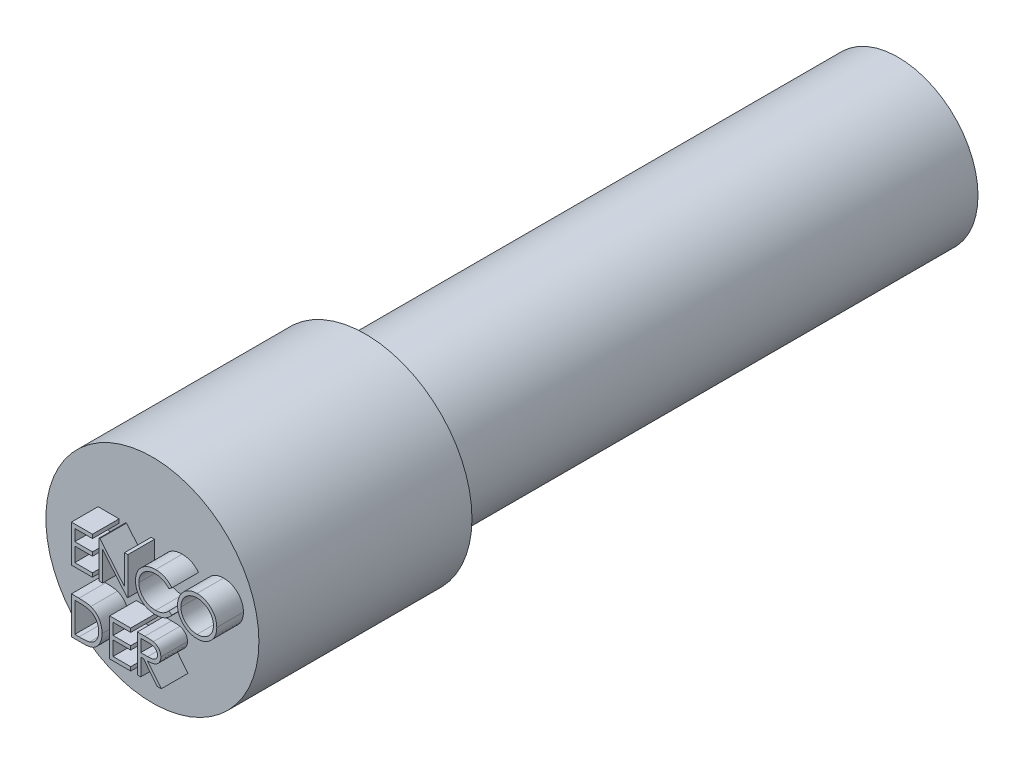
from build123d import *

# Parameters (mm, degrees)
SKETCH1_R           = 1.5
BOSS_EXTRUDE1_DEPTH = 10
SKETCH2_R           = 2
BOSS_EXTRUDE2_DEPTH = 4
BOSS_EXTRUDE3_DEPTH = 0.5


with BuildPart() as part:
    # Sketch1 → Boss-Extrude1 (new body)
    with BuildSketch(Plane.XY):
        with Locations((0, 2.269253886)):
            Circle(SKETCH1_R)
    extrude(amount=BOSS_EXTRUDE1_DEPTH)

    # Sketch2 → Boss-Extrude2 (add)
    with BuildSketch(Plane.XY.offset(10)):
        with Locations((0, 2.269253886)):
            Circle(SKETCH2_R)
    extrude(amount=BOSS_EXTRUDE2_DEPTH)

    # Sketch3 → Boss-Extrude3 (add)
    # profile 1 of 7: a face of its own
    with BuildSketch(Plane.XY.offset(14)):
        Polygon((-1.019314655, 2.951432691), (-0.62444286, 2.951432691), (-0.62444286, 2.879637819), (-0.956494142, 2.879637819), (-0.956494142, 2.664253204), (-0.62444286, 2.664253204), (-0.62444286, 2.592458332), (-0.956494142, 2.592458332), (-0.956494142, 2.323227563), (-0.62444286, 2.323227563), (-0.62444286, 2.251432691), (-1.019314655, 2.251432691), align=None)
    # profile 2 of 7: a face of its own
    with BuildSketch(Plane.XY.offset(14)):
        Polygon((-0.498801835, 2.251432691), (-0.498801835, 2.951432691), (-0.485620745, 2.951432691), (-0.023160809, 2.400491185), (-0.023160809, 2.951432691), (0.039659704, 2.951432691), (0.039659704, 2.251432691), (0.025356819, 2.251432691), (-0.435981322, 2.801112178), (-0.435981322, 2.251432691), align=None)
    # profile 3 of 7: a face of its own
    with BuildSketch(Plane.XY.offset(14)):
        with BuildLine():
            Line((0.86530073, 2.822987178), (0.810332781, 2.780919871))
            add(Edge.make_bspline(
                [(0.810332781, 2.780919871), (0.806411603, 2.785593065), (0.798622114, 2.794876448), (0.786090273, 2.807912357), (0.773029945, 2.820125409), (0.75944612, 2.831573785), (0.745094297, 2.841857138), (0.730322137, 2.851511359), (0.714882528, 2.860164906), (0.693532181, 2.870657503), (0.665602611, 2.881606734), (0.630443643, 2.890787381), (0.593741424, 2.896631616), (0.568701904, 2.897264584), (0.555965794, 2.897586537)],
                knots=[0, 0, 0, 0, 0.757959112, 1.505699292, 2.245454638, 2.979532153, 3.711538275, 4.438200793, 5.171680507, 5.909471876, 7.393775596, 8.890124382, 10.418191784, 12, 12, 12, 12], degree=3))
            add(Edge.make_bspline(
                [(0.555965794, 2.897586537), (0.548949134, 2.897505745), (0.534980935, 2.89734491), (0.514251241, 2.895223085), (0.49390863, 2.892240843), (0.473966337, 2.887815778), (0.454449745, 2.882221254), (0.435231265, 2.875536171), (0.416589145, 2.867265203), (0.398265497, 2.858123551), (0.380709655, 2.847798063), (0.364098646, 2.836535392), (0.348493052, 2.824461573), (0.33388053, 2.811531352), (0.32024614, 2.797802959), (0.307688678, 2.783130091), (0.296251596, 2.767559656), (0.285708191, 2.751296975), (0.276265644, 2.734389417), (0.268359668, 2.716774403), (0.261358644, 2.698753582), (0.255818795, 2.68012335), (0.251433892, 2.661014797), (0.248408359, 2.641376639), (0.246310665, 2.621249903), (0.24615063, 2.607608041), (0.24606996, 2.600731569)],
                knots=[0, 0, 0, 0, 1.054917814, 2.100044995, 3.131103042, 4.146048494, 5.169673617, 6.183595914, 7.203665975, 8.234915748, 9.262203917, 10.264457458, 11.251630812, 12.227803204, 13.197192746, 14.159520551, 15.12972552, 16.100847026, 17.073214652, 18.039054194, 19.002613845, 19.979014051, 20.95965708, 21.949030935, 22.966165397, 24, 24, 24, 24], degree=3))
            add(Edge.make_bspline(
                [(0.24606996, 2.600731569), (0.246322324, 2.590385305), (0.246817807, 2.570071788), (0.251227474, 2.540317666), (0.257928492, 2.511813532), (0.267971607, 2.484737563), (0.280355418, 2.458755892), (0.29600354, 2.434308121), (0.314126847, 2.411024808), (0.334981731, 2.389456218), (0.357862894, 2.369753473), (0.382412477, 2.352403357), (0.408569334, 2.337940381), (0.43604466, 2.325905191), (0.465049883, 2.316653846), (0.495532844, 2.310141021), (0.527427243, 2.305892585), (0.549221123, 2.305485847), (0.560312749, 2.305278845)],
                knots=[0, 0, 0, 0, 1.029171465, 2.020641659, 2.987623507, 3.938342917, 4.889210282, 5.84687017, 6.821220943, 7.821438502, 8.827599549, 9.822697543, 10.807740252, 11.797342354, 12.80366471, 13.83203677, 14.896651826, 16, 16, 16, 16], degree=3))
            add(Edge.make_bspline(
                [(0.560312749, 2.305278845), (0.572533287, 2.305616601), (0.596586228, 2.306281386), (0.631859834, 2.311913235), (0.665626987, 2.321044819), (0.697889504, 2.333824403), (0.728556433, 2.350437461), (0.757675765, 2.370577036), (0.785272079, 2.394434703), (0.801866336, 2.412651329), (0.810332781, 2.421945512)],
                knots=[0, 0, 0, 0, 1.028121516, 2.023589091, 2.998037872, 3.967518031, 4.937445131, 5.927275754, 6.942489185, 8, 8, 8, 8], degree=3))
            Line((0.810332781, 2.421945512), (0.86530073, 2.380298877))
            add(Edge.make_bspline(
                [(0.86530073, 2.380298877), (0.860877108, 2.374591187), (0.852051052, 2.363203145), (0.837759449, 2.347148804), (0.82270399, 2.332047996), (0.806772848, 2.318022472), (0.790149289, 2.304791579), (0.772534827, 2.292731213), (0.75416102, 2.281673036), (0.735090125, 2.271547651), (0.715342402, 2.262564202), (0.694941515, 2.254873448), (0.6739754, 2.24824847), (0.652443098, 2.242798083), (0.630299947, 2.238543866), (0.607625852, 2.235699931), (0.584371877, 2.233751548), (0.568683593, 2.233573965), (0.560733422, 2.233483973)],
                knots=[0, 0, 0, 0, 0.986787822, 1.968848986, 2.935600012, 3.899624008, 4.868462664, 5.837806735, 6.815139263, 7.798259679, 8.787526145, 9.778297419, 10.776456485, 11.791383307, 12.812564526, 13.85620153, 14.913611965, 16, 16, 16, 16], degree=3))
            add(Edge.make_bspline(
                [(0.560733422, 2.233483973), (0.553204688, 2.233536372), (0.53831755, 2.233639983), (0.5163378, 2.235318417), (0.494939884, 2.237608364), (0.474184959, 2.24105639), (0.453959764, 2.245125258), (0.434447647, 2.25057951), (0.415456605, 2.256689343), (0.397062937, 2.26387034), (0.379250997, 2.271973577), (0.362078234, 2.281131889), (0.345552548, 2.291268262), (0.329511464, 2.302159264), (0.314191947, 2.314154724), (0.299461242, 2.327088051), (0.285236747, 2.340915653), (0.27643621, 2.350886624), (0.272011467, 2.355899839)],
                knots=[0, 0, 0, 0, 1.114604814, 2.203992996, 3.262667896, 4.300477797, 5.318619304, 6.316056647, 7.298880507, 8.271930387, 9.238335007, 10.195173496, 11.151986948, 12.108099108, 13.064862484, 14.031167946, 15.010108607, 16, 16, 16, 16], degree=3))
            add(Edge.make_bspline(
                [(0.272011467, 2.355899839), (0.264924338, 2.364608076), (0.250835643, 2.381919419), (0.232810506, 2.409976615), (0.217380995, 2.439270257), (0.204905811, 2.469954242), (0.195153264, 2.50195972), (0.188397025, 2.535302823), (0.184006704, 2.569952411), (0.183504646, 2.593519769), (0.183249447, 2.605499198)],
                knots=[0, 0, 0, 0, 0.994628077, 1.977248131, 2.950237994, 3.925870899, 4.908910175, 5.911660606, 6.938484602, 8, 8, 8, 8], degree=3))
            add(Edge.make_bspline(
                [(0.183249447, 2.605499198), (0.183560486, 2.618090288), (0.184172435, 2.642862473), (0.189371595, 2.679217264), (0.197735354, 2.714047544), (0.209614731, 2.747288293), (0.224675802, 2.779114349), (0.243281124, 2.80928259), (0.265214553, 2.83798595), (0.290304066, 2.8647889), (0.317817534, 2.88929677), (0.347281296, 2.910858011), (0.378637686, 2.928801514), (0.411541256, 2.943800747), (0.446238392, 2.955329639), (0.482655066, 2.963400277), (0.520722849, 2.9684237), (0.546695334, 2.969058742), (0.559892076, 2.969381409)],
                knots=[0, 0, 0, 0, 1.032925535, 2.032216505, 3.007276963, 3.968222605, 4.92396291, 5.891752235, 6.871517503, 7.883894988, 8.900124299, 9.891468569, 10.874487609, 11.85992873, 12.854644235, 13.869047385, 14.917252991, 16, 16, 16, 16], degree=3))
            add(Edge.make_bspline(
                [(0.559892076, 2.969381409), (0.56793497, 2.969284982), (0.58385507, 2.969094113), (0.6074056, 2.967232884), (0.630334065, 2.964130163), (0.652656262, 2.959906949), (0.674480785, 2.954665485), (0.695640833, 2.947837425), (0.716260571, 2.940030119), (0.736209952, 2.931038426), (0.755393262, 2.920945077), (0.773804526, 2.909861953), (0.791297498, 2.897802792), (0.807995267, 2.884870157), (0.82361851, 2.870790445), (0.838610805, 2.855950925), (0.852463021, 2.839924161), (0.86101366, 2.828643174), (0.86530073, 2.822987178)],
                knots=[0, 0, 0, 0, 1.096760587, 2.17092713, 3.219439832, 4.250915756, 5.268269357, 6.278326846, 7.281116186, 8.274029601, 9.260640565, 10.235837813, 11.203064059, 12.156899882, 13.114053108, 14.069676657, 15.032185724, 16, 16, 16, 16], degree=3))
        make_face()
    # profile 4 of 7: a face of its own
    with BuildSketch(Plane.XY.offset(14)):
        with BuildLine():
            add(Edge.make_bspline(
                [(1.336454576, 2.969381409), (1.349416197, 2.969053113), (1.37487389, 2.968408313), (1.41228887, 2.963472492), (1.448007889, 2.954933414), (1.482321917, 2.943560818), (1.514820512, 2.928389941), (1.54574829, 2.910052911), (1.575031665, 2.888357619), (1.602275941, 2.863471774), (1.627207332, 2.836395083), (1.649172509, 2.807499501), (1.667580968, 2.776959741), (1.682698125, 2.744867575), (1.694557847, 2.711295581), (1.702741656, 2.676064781), (1.707969286, 2.639403443), (1.708580441, 2.61439807), (1.708890473, 2.60171314)],
                knots=[0, 0, 0, 0, 1.065120563, 2.091984664, 3.0946048, 4.079830382, 5.057816894, 6.036188127, 7.030412546, 8.04752943, 9.064399622, 10.05169764, 11.02544977, 11.989514704, 12.962713494, 13.945757189, 14.957906945, 16, 16, 16, 16], degree=3))
            add(Edge.make_bspline(
                [(1.708890473, 2.60171314), (1.708580487, 2.589121651), (1.707969467, 2.564302367), (1.702735712, 2.527873678), (1.694527512, 2.492855538), (1.682808259, 2.459306408), (1.667763163, 2.427190895), (1.649232129, 2.396593504), (1.627403886, 2.367504205), (1.602562516, 2.340241672), (1.575482308, 2.315242178), (1.546436254, 2.293458402), (1.516077591, 2.274713577), (1.484015649, 2.259756843), (1.450675642, 2.247802459), (1.415759177, 2.239651933), (1.379429866, 2.234394524), (1.354655665, 2.233790821), (1.34206355, 2.233483973)],
                knots=[0, 0, 0, 0, 1.043624062, 2.057103931, 3.04512605, 4.022047818, 4.998200453, 5.980619268, 6.982898556, 8.009068085, 9.034988726, 10.034168286, 11.015286542, 11.987931943, 12.962482838, 13.94673481, 14.956375938, 16, 16, 16, 16], degree=3))
            add(Edge.make_bspline(
                [(1.34206355, 2.233483973), (1.329378686, 2.233793851), (1.304373443, 2.234404701), (1.267666036, 2.239640982), (1.232410487, 2.247829243), (1.198707617, 2.25953113), (1.166538631, 2.274654577), (1.135840614, 2.293095452), (1.106736785, 2.314976881), (1.079468436, 2.339810196), (1.054518596, 2.366844506), (1.032766721, 2.395811357), (1.014321698, 2.426142448), (0.999249032, 2.457921953), (0.98731614, 2.490996242), (0.979175176, 2.525585937), (0.973907986, 2.561493838), (0.973301017, 2.585942418), (0.972993037, 2.598347755)],
                knots=[0, 0, 0, 0, 1.053102029, 2.075944431, 3.073151272, 4.055350789, 5.033113405, 6.020478099, 7.024410459, 8.052272461, 9.079885166, 10.07527673, 11.055994387, 12.023226415, 12.992069828, 13.970394897, 14.97016774, 16, 16, 16, 16], degree=3))
            add(Edge.make_bspline(
                [(0.972993037, 2.598347755), (0.973099964, 2.606674289), (0.97331247, 2.623222314), (0.975870808, 2.647795634), (0.979583148, 2.671973765), (0.984903531, 2.695687955), (0.991861864, 2.718880152), (1.00007227, 2.741710305), (1.010100239, 2.763947049), (1.021436368, 2.785695728), (1.03408873, 2.806617309), (1.04806388, 2.826393225), (1.062870954, 2.845189425), (1.079103632, 2.862518826), (1.096226921, 2.878885557), (1.114518597, 2.8940381), (1.133867046, 2.90811309), (1.154355522, 2.920797159), (1.175479177, 2.932268986), (1.197254532, 2.942113356), (1.219385847, 2.950562568), (1.241976776, 2.957410733), (1.264967331, 2.96281714), (1.288407688, 2.966498611), (1.312279173, 2.969063475), (1.328361437, 2.969274975), (1.336454576, 2.969381409)],
                knots=[0, 0, 0, 0, 1.037015668, 2.060948919, 3.074880161, 4.083647147, 5.086022904, 6.090072063, 7.104153813, 8.122640571, 9.144368836, 10.147691507, 11.138137339, 12.123020368, 13.103399296, 14.087645067, 15.080126199, 16.082011238, 17.087798457, 18.072939717, 19.057185487, 20.037253025, 21.01195951, 21.997135196, 22.992090687, 24, 24, 24, 24], degree=3))
        make_face()
        with BuildLine():
            add(Edge.make_bspline(
                [(1.339539512, 2.897586537), (1.332896585, 2.897505559), (1.319674238, 2.897344377), (1.300017331, 2.895221234), (1.280618944, 2.892195256), (1.261475072, 2.887878952), (1.242665814, 2.881998142), (1.224015846, 2.87522996), (1.205695235, 2.866985742), (1.187764463, 2.857671201), (1.170381448, 2.847361417), (1.153978908, 2.835967064), (1.138514379, 2.823755353), (1.124025726, 2.810697785), (1.110555491, 2.796727865), (1.097838551, 2.782057378), (1.086384635, 2.766266999), (1.075887519, 2.749784918), (1.066493951, 2.732632602), (1.05814088, 2.714990629), (1.051308079, 2.696715092), (1.045735603, 2.678004261), (1.041115641, 2.658887769), (1.038188856, 2.639220599), (1.036042385, 2.619101576), (1.035890416, 2.605505206), (1.03581355, 2.598628204)],
                knots=[0, 0, 0, 0, 1.008559885, 2.007477868, 2.99961109, 3.989939068, 4.984837346, 5.991145699, 7.001802488, 8.033829008, 9.059044045, 10.069351652, 11.065060232, 12.050310815, 13.029377138, 14.011219647, 14.996725999, 15.989392538, 16.977580475, 17.965360261, 18.951710183, 19.937753436, 20.929683414, 21.935841486, 22.955955122, 24, 24, 24, 24], degree=3))
            add(Edge.make_bspline(
                [(1.03581355, 2.598628204), (1.036068522, 2.58851576), (1.036570132, 2.568621454), (1.040961646, 2.539467825), (1.047726041, 2.511450168), (1.057697514, 2.484721786), (1.070167637, 2.459052929), (1.085573015, 2.434671308), (1.103824832, 2.411570334), (1.124557538, 2.38991128), (1.147222079, 2.370142119), (1.171288625, 2.352789437), (1.196499346, 2.338107387), (1.222919987, 2.326146373), (1.250409495, 2.316668425), (1.279145005, 2.310172699), (1.308935097, 2.305897608), (1.329241228, 2.305487057), (1.339539512, 2.305278845)],
                knots=[0, 0, 0, 0, 1.032063989, 2.030389145, 3.003944642, 3.970395727, 4.937377036, 5.913328081, 6.909231446, 7.93887556, 8.970685674, 9.976071282, 10.964166581, 11.944589148, 12.933237628, 13.927779006, 14.949070134, 16, 16, 16, 16], degree=3))
            add(Edge.make_bspline(
                [(1.339539512, 2.305278845), (1.346461412, 2.305373946), (1.360189619, 2.30556256), (1.380608724, 2.307462295), (1.400659966, 2.310508669), (1.420315222, 2.3148948), (1.439552184, 2.320384241), (1.458451145, 2.326905787), (1.476810803, 2.335042028), (1.49486277, 2.344031618), (1.512142019, 2.354279649), (1.528637125, 2.365287279), (1.543932321, 2.377481003), (1.558410136, 2.390344566), (1.571935673, 2.404137336), (1.58441747, 2.41884138), (1.595813497, 2.434549511), (1.606306626, 2.451006592), (1.615667278, 2.468205843), (1.623823098, 2.485911779), (1.630742321, 2.5040808), (1.636328022, 2.522739115), (1.640705115, 2.541851285), (1.643721099, 2.5614429), (1.645830786, 2.581474769), (1.645989802, 2.59502354), (1.64606996, 2.601853364)],
                knots=[0, 0, 0, 0, 1.047197238, 2.076906641, 3.100256066, 4.114471768, 5.12198147, 6.126382909, 7.136867548, 8.15857795, 9.17633901, 10.174870724, 11.156907918, 12.133735059, 13.104061851, 14.077631395, 15.04955518, 16.038496417, 17.029181396, 18.010275684, 18.986308667, 19.968651475, 20.955262928, 21.950658345, 22.966943676, 24, 24, 24, 24], degree=3))
            add(Edge.make_bspline(
                [(1.64606996, 2.601853364), (1.645989738, 2.608636465), (1.645830601, 2.622091995), (1.643722106, 2.641984159), (1.640701928, 2.661434801), (1.636349387, 2.680367562), (1.630739356, 2.698787267), (1.62382189, 2.716676616), (1.61566483, 2.734102255), (1.606303185, 2.751021115), (1.59578002, 2.767256062), (1.584281172, 2.782776545), (1.571608102, 2.797291093), (1.558122897, 2.811158032), (1.54348872, 2.82408161), (1.527771861, 2.836066114), (1.511163126, 2.847400769), (1.493577679, 2.857625881), (1.475428888, 2.867068728), (1.456806096, 2.875158928), (1.437920276, 2.882033352), (1.418819454, 2.887896745), (1.399342858, 2.892178351), (1.379622093, 2.895223961), (1.359684441, 2.897343638), (1.346275797, 2.897505314), (1.339539512, 2.897586537)],
                knots=[0, 0, 0, 0, 1.02996197, 2.043119294, 3.035359645, 4.018872909, 4.991431989, 5.957985074, 6.929999688, 7.912076566, 8.892894881, 9.867085534, 10.843653904, 11.817741046, 12.803660682, 13.806313499, 14.818574707, 15.856120519, 16.894564902, 17.924820532, 18.937903209, 19.946497019, 20.957711757, 21.963978472, 22.977135795, 24, 24, 24, 24], degree=3))
        make_face(mode=Mode.SUBTRACT)
    # profile 5 of 7: a face of its own
    with BuildSketch(Plane.XY.offset(14)):
        with BuildLine():
            Line((-1.019314655, 1.084766025), (-1.019314655, 1.784766025))
            Line((-1.019314655, 1.784766025), (-0.877968501, 1.784766025))
            add(Edge.make_bspline(
                [(-0.877968501, 1.784766025), (-0.865674704, 1.784677511), (-0.841923151, 1.784506502), (-0.807600661, 1.783422224), (-0.775843909, 1.781504131), (-0.746757337, 1.778710225), (-0.720261094, 1.775279619), (-0.696429373, 1.770979538), (-0.675138944, 1.765901904), (-0.662045056, 1.761572814), (-0.655853117, 1.75952564)],
                knots=[0, 0, 0, 0, 1.314313732, 2.53924729, 3.670748893, 4.714932338, 5.66265055, 6.526160246, 7.303039223, 8, 8, 8, 8], degree=3))
            add(Edge.make_bspline(
                [(-0.655853117, 1.75952564), (-0.647754169, 1.756439499), (-0.63173993, 1.7503372), (-0.608938506, 1.73882594), (-0.587473433, 1.725783319), (-0.567229604, 1.711192147), (-0.548669439, 1.694639277), (-0.53106786, 1.67682786), (-0.515144915, 1.657110192), (-0.500563256, 1.635895194), (-0.487416124, 1.613432784), (-0.475988292, 1.589765762), (-0.466497494, 1.565014321), (-0.458618848, 1.539247291), (-0.452409557, 1.512408015), (-0.44817317, 1.484465242), (-0.445378972, 1.455529404), (-0.445098162, 1.435894512), (-0.444955681, 1.42593189)],
                knots=[0, 0, 0, 0, 0.984719456, 1.947108742, 2.898477687, 3.838006223, 4.779231079, 5.722358779, 6.681677486, 7.655904652, 8.64651281, 9.637519902, 10.640069247, 11.656948941, 12.698408672, 13.768548281, 14.867775369, 16, 16, 16, 16], degree=3))
            add(Edge.make_bspline(
                [(-0.444955681, 1.42593189), (-0.445081474, 1.417279642), (-0.445329363, 1.400229484), (-0.447555227, 1.375101305), (-0.450790491, 1.350718591), (-0.45579933, 1.327197451), (-0.461879833, 1.304331807), (-0.469672663, 1.282365359), (-0.478599762, 1.261096597), (-0.489009738, 1.240813102), (-0.500438015, 1.221596427), (-0.512702364, 1.203481321), (-0.525789703, 1.186726277), (-0.539824829, 1.171280555), (-0.554626373, 1.157167439), (-0.570291239, 1.144269036), (-0.586859849, 1.132837725), (-0.604257994, 1.122424303), (-0.622993219, 1.113340232), (-0.643420393, 1.10565423), (-0.665626628, 1.099284907), (-0.68955742, 1.093970728), (-0.715254115, 1.089755268), (-0.742741908, 1.086929989), (-0.771978566, 1.085019403), (-0.792054419, 1.084852124), (-0.802387572, 1.084766025)],
                knots=[0, 0, 0, 0, 1.105936401, 2.179363191, 3.223086493, 4.248585256, 5.251745608, 6.245858792, 7.225916811, 8.198733463, 9.158002045, 10.082870192, 10.993790845, 11.873723703, 12.748670949, 13.606408763, 14.465103618, 15.319838547, 16.196477973, 17.123216899, 18.106603292, 19.147568657, 20.255746949, 21.433717677, 22.679120308, 24, 24, 24, 24], degree=3))
            Line((-0.802387572, 1.084766025), (-1.019314655, 1.084766025))
        make_face()
        with BuildLine():
            Line((-0.956494142, 1.156560896), (-0.876145585, 1.156560896))
            add(Edge.make_bspline(
                [(-0.876145585, 1.156560896), (-0.86459991, 1.156610516), (-0.842393351, 1.156705952), (-0.810461751, 1.157543392), (-0.781285872, 1.15891178), (-0.75486157, 1.160826795), (-0.731203765, 1.163360518), (-0.710263015, 1.166185499), (-0.692107964, 1.169704989), (-0.681122076, 1.172895181), (-0.676045424, 1.17436939)],
                knots=[0, 0, 0, 0, 1.375205317, 2.645023457, 3.804390687, 4.853969522, 5.800190428, 6.637939096, 7.370582563, 8, 8, 8, 8], degree=3))
            add(Edge.make_bspline(
                [(-0.676045424, 1.17436939), (-0.669655752, 1.176619702), (-0.657029024, 1.181066576), (-0.638852807, 1.189178108), (-0.621901406, 1.198786522), (-0.605879401, 1.209466977), (-0.59101407, 1.221596178), (-0.577129247, 1.234910375), (-0.564252887, 1.24947733), (-0.552518025, 1.265278963), (-0.542016364, 1.282216922), (-0.532922118, 1.300124689), (-0.524951812, 1.318806051), (-0.518696094, 1.338547882), (-0.513792977, 1.359173694), (-0.510320039, 1.380684937), (-0.508157094, 1.403077593), (-0.507904805, 1.418308018), (-0.507776194, 1.426072114)],
                knots=[0, 0, 0, 0, 0.998632004, 1.973411704, 2.929992603, 3.868527914, 4.809262121, 5.754881198, 6.702106254, 7.672490631, 8.653608572, 9.636854334, 10.631411391, 11.644891563, 12.686317036, 13.754757253, 14.855430412, 16, 16, 16, 16], degree=3))
            add(Edge.make_bspline(
                [(-0.507776194, 1.426072114), (-0.507878851, 1.43425881), (-0.508080523, 1.450341647), (-0.510615385, 1.473939786), (-0.514319696, 1.496635916), (-0.519676433, 1.518431555), (-0.526502609, 1.539369226), (-0.535021537, 1.559333128), (-0.544754861, 1.578534102), (-0.556335528, 1.596528975), (-0.569018647, 1.613547597), (-0.583094223, 1.62913858), (-0.598338631, 1.64333744), (-0.6145856, 1.656365302), (-0.63229302, 1.667698038), (-0.651043758, 1.677835374), (-0.671112893, 1.686438552), (-0.685075432, 1.691014325), (-0.692171226, 1.693339743)],
                knots=[0, 0, 0, 0, 1.122418816, 2.205001699, 3.251619955, 4.274784885, 5.280384055, 6.268708349, 7.249350384, 8.229342522, 9.199999885, 10.157847722, 11.105861043, 12.055065948, 13.010012805, 13.98527497, 14.976112212, 16, 16, 16, 16], degree=3))
            add(Edge.make_bspline(
                [(-0.692171226, 1.693339743), (-0.698041455, 1.694963028), (-0.710523173, 1.698414579), (-0.730891066, 1.702179653), (-0.753814096, 1.705500553), (-0.779394036, 1.708312161), (-0.807601728, 1.710329625), (-0.838458865, 1.711843888), (-0.871978786, 1.712865214), (-0.895215293, 1.712934956), (-0.907275392, 1.712971153)],
                knots=[0, 0, 0, 0, 0.674548936, 1.434276114, 2.292660221, 3.240891867, 4.284742987, 5.42552168, 6.663806718, 8, 8, 8, 8], degree=3))
            Line((-0.907275392, 1.712971153), (-0.956494142, 1.712971153))
            Line((-0.956494142, 1.712971153), (-0.956494142, 1.156560896))
        make_face(mode=Mode.SUBTRACT)
    # profile 6 of 7: a face of its own
    with BuildSketch(Plane.XY.offset(14)):
        Polygon((-0.301365937, 1.784766025), (0.093505858, 1.784766025), (0.093505858, 1.712971153), (-0.238545424, 1.712971153), (-0.238545424, 1.497586537), (0.093505858, 1.497586537), (0.093505858, 1.425791666), (-0.238545424, 1.425791666), (-0.238545424, 1.156560896), (0.093505858, 1.156560896), (0.093505858, 1.084766025), (-0.301365937, 1.084766025), align=None)
    # profile 7 of 7: a face of its own
    with BuildSketch(Plane.XY.offset(14)):
        with BuildLine():
            Line((0.219146883, 1.784766025), (0.359231018, 1.784766025))
            add(Edge.make_bspline(
                [(0.359231018, 1.784766025), (0.368579244, 1.784734907), (0.386528873, 1.784675159), (0.412243527, 1.784342006), (0.435608946, 1.783387135), (0.456612914, 1.782565418), (0.475255045, 1.78106703), (0.491592503, 1.779634901), (0.505550043, 1.777760169), (0.513999213, 1.776019084), (0.517824768, 1.775230768)],
                knots=[0, 0, 0, 0, 1.410062039, 2.707475311, 3.878576406, 4.937260626, 5.877586885, 6.699081471, 7.410979367, 8, 8, 8, 8], degree=3))
            add(Edge.make_bspline(
                [(0.517824768, 1.775230768), (0.522946093, 1.773965415), (0.533079491, 1.771461702), (0.547669504, 1.766169782), (0.561572369, 1.760045857), (0.574730334, 1.752853113), (0.587077492, 1.744538157), (0.598741154, 1.735244533), (0.609774247, 1.725023092), (0.619730573, 1.713616123), (0.629118383, 1.701648821), (0.637036108, 1.68870807), (0.643861404, 1.675175765), (0.649295508, 1.660914281), (0.653671102, 1.646061927), (0.65675635, 1.630484167), (0.658606588, 1.614251972), (0.658794959, 1.60318039), (0.658890473, 1.597566505)],
                knots=[0, 0, 0, 0, 1.027469482, 2.033020251, 3.019912614, 3.986113645, 4.951240523, 5.91722682, 6.890402269, 7.87763091, 8.8651537, 9.85103654, 10.82876324, 11.815024772, 12.821070561, 13.842952187, 14.906261191, 16, 16, 16, 16], degree=3))
            add(Edge.make_bspline(
                [(0.658890473, 1.597566505), (0.658596673, 1.588239484), (0.658023394, 1.570040051), (0.652678374, 1.543627875), (0.64392307, 1.518990012), (0.631858412, 1.496157484), (0.616494517, 1.475575355), (0.598029558, 1.457497264), (0.576453236, 1.442369281), (0.556367373, 1.43187872), (0.538624533, 1.425160139), (0.52401787, 1.420432867), (0.508084475, 1.416780474), (0.490977008, 1.413508448), (0.472624277, 1.411038109), (0.453070269, 1.40922879), (0.432301039, 1.40809798), (0.418033225, 1.407929579), (0.410693358, 1.407842948)],
                knots=[0, 0, 0, 0, 1.260483769, 2.459530307, 3.627416485, 4.787058657, 5.939039949, 7.08810263, 8.267026773, 9.491475466, 10.141966685, 10.831826277, 11.566392101, 12.351337768, 13.187381173, 14.07005841, 15.007169909, 16, 16, 16, 16], degree=3))
            Line((0.410693358, 1.407842948), (0.667864832, 1.084766025))
            Line((0.667864832, 1.084766025), (0.590180537, 1.084766025))
            Line((0.590180537, 1.084766025), (0.333009063, 1.407842948))
            Line((0.333009063, 1.407842948), (0.281967396, 1.407842948))
            Line((0.281967396, 1.407842948), (0.281967396, 1.084766025))
            Line((0.281967396, 1.084766025), (0.219146883, 1.084766025))
            Line((0.219146883, 1.084766025), (0.219146883, 1.784766025))
        make_face()
        with BuildLine():
            Line((0.281967396, 1.712971153), (0.281967396, 1.479637819))
            Line((0.281967396, 1.479637819), (0.41013246, 1.478656249))
            add(Edge.make_bspline(
                [(0.41013246, 1.478656249), (0.416116468, 1.478653602), (0.427715179, 1.47864847), (0.444495312, 1.479447226), (0.460119335, 1.480355889), (0.474527485, 1.481745758), (0.4877262, 1.483536973), (0.499708883, 1.48577757), (0.510495093, 1.488387982), (0.523074801, 1.492428307), (0.537122107, 1.498829511), (0.552388399, 1.508142611), (0.565388867, 1.519856434), (0.576372439, 1.533251126), (0.585198326, 1.547978375), (0.591420736, 1.563861649), (0.595369225, 1.580499969), (0.595834934, 1.59193559), (0.59606996, 1.59770673)],
                knots=[0, 0, 0, 0, 1.146690395, 2.22261258, 3.21895312, 4.145990853, 4.996080663, 5.770904154, 6.481378293, 7.121626537, 8.300444488, 9.431385265, 10.535395872, 11.636531494, 12.74115979, 13.810798291, 14.895190096, 16, 16, 16, 16], degree=3))
            add(Edge.make_bspline(
                [(0.59606996, 1.59770673), (0.595829536, 1.603336044), (0.595353103, 1.614491292), (0.591463349, 1.630822474), (0.584885473, 1.646235864), (0.576021025, 1.660668761), (0.565221194, 1.673769908), (0.552557632, 1.684979339), (0.538376593, 1.694229232), (0.525122353, 1.700140108), (0.513275511, 1.703764079), (0.502989579, 1.706314311), (0.491367283, 1.708363205), (0.478352191, 1.710004817), (0.463999865, 1.711415806), (0.448237735, 1.712366162), (0.431170379, 1.712928935), (0.419340993, 1.712956753), (0.413217396, 1.712971153)],
                knots=[0, 0, 0, 0, 1.101028733, 2.181837193, 3.264309656, 4.369019818, 5.486613113, 6.575447106, 7.666700264, 8.788928104, 9.402425223, 10.0903467, 10.862060571, 11.710948788, 12.657782767, 13.684531032, 14.801375019, 16, 16, 16, 16], degree=3))
            Line((0.413217396, 1.712971153), (0.281967396, 1.712971153))
        make_face(mode=Mode.SUBTRACT)
    extrude(amount=BOSS_EXTRUDE3_DEPTH)


solid = part.part
